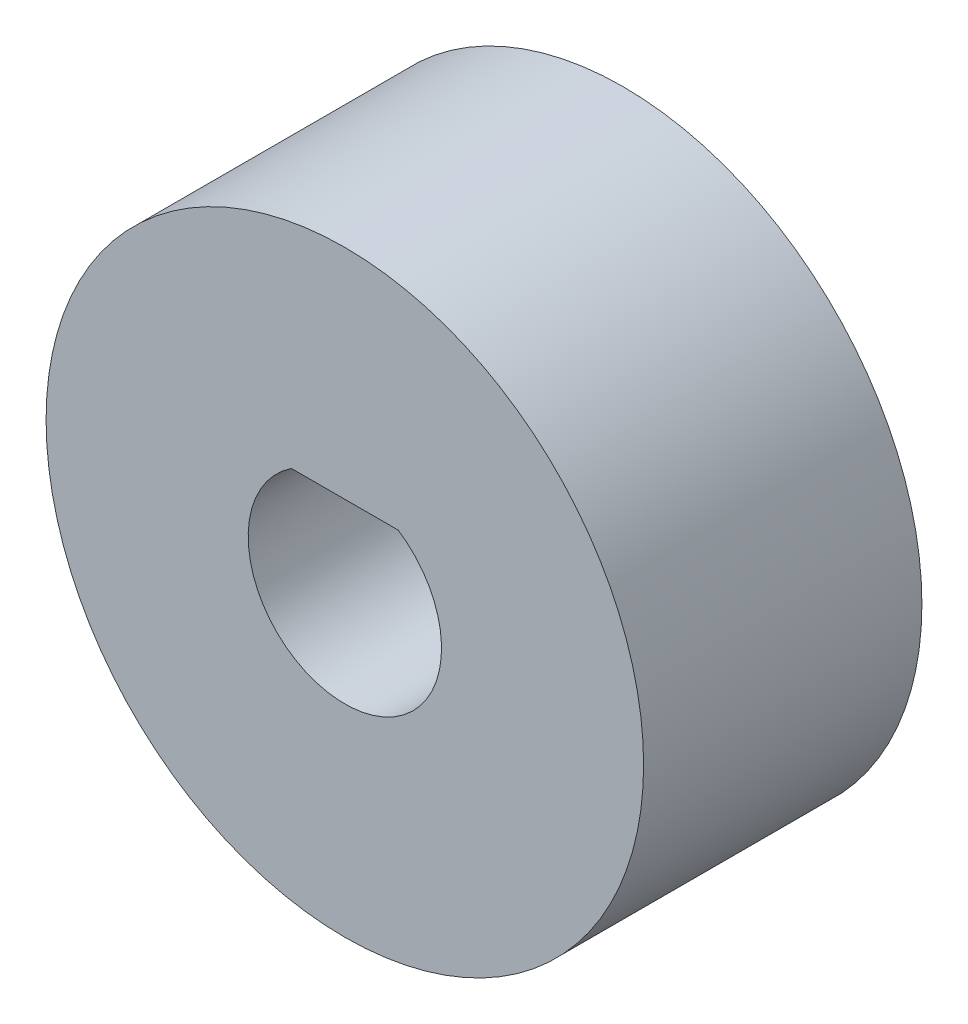
from build123d import *

# Parameters (mm, degrees)
SKETCH1_R           = 9.271
BOSS_EXTRUDE1_DEPTH = 8.636


with BuildPart() as part:
    # Sketch1 → Boss-Extrude1 (new body)
    with BuildSketch(Plane.XY):
        Circle(SKETCH1_R)
        with BuildLine():
            Line((1.658310586, 2.499994), (-1.658310586, 2.499994))
            ThreePointArc((-1.658310586, 2.499994), (0, -2.999994), (1.658310586, 2.499994))
        make_face(mode=Mode.SUBTRACT)
    extrude(amount=BOSS_EXTRUDE1_DEPTH)


solid = part.part
